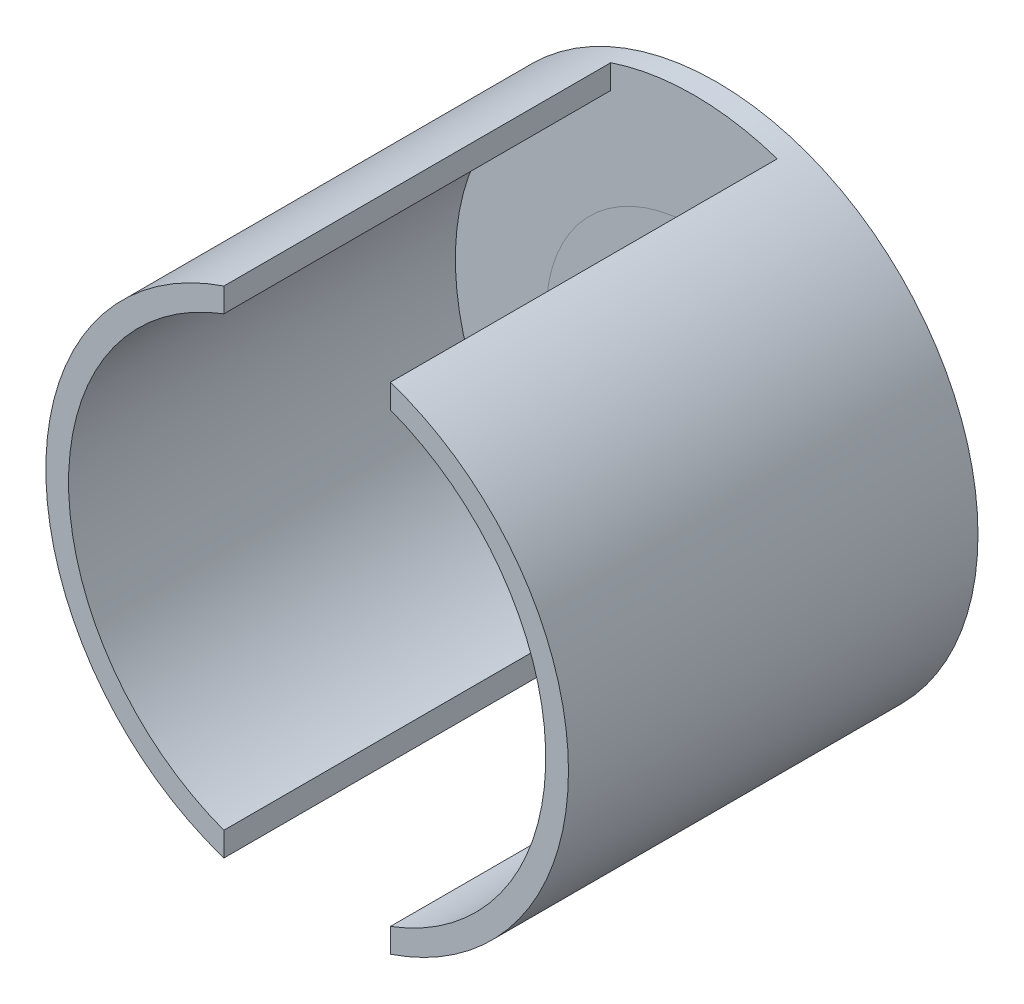
from build123d import *

# Parameters (mm, degrees)
SCHIZZO1_R                    = 19.5
SCHIZZO1_R_2                  = 1.75
ESTRUSIONE_ESTRUSIONE1_DEPTH  = 3
TAGLIO_ESTRUSIONE1_DEPTH      = 1
SCHIZZO5_R                    = 34.52
SCHIZZO5_R_2                  = 19.5
ESTRUSIONE_ESTRUSIONE4_DEPTH  = 3
SCHIZZO6_R                    = 34.52
SCHIZZO6_R_2                  = 31.52
ESTRUSIONE_ESTRUSIONE5_DEPTH  = 51.1
TAGLIO_ESTRUSIONE2_DEPTH      = 73.870232606
TAGLIO_ESTRUSIONE2_DEPTH_BACK = 73.870232606
SCHIZZO7_W                    = 22
SCHIZZO7_H                    = 51.1


with BuildPart() as part:
    # Schizzo1 → Estrusione-Estrusione1 (new body)
    with BuildSketch(Plane.XY):
        Circle(SCHIZZO1_R)
        with Locations((5.5, 9)):
            Circle(SCHIZZO1_R_2, mode=Mode.SUBTRACT)
        with Locations((-5.5, 9)):
            Circle(SCHIZZO1_R_2, mode=Mode.SUBTRACT)
        with Locations((-5.5, -9)):
            Circle(SCHIZZO1_R_2, mode=Mode.SUBTRACT)
        with Locations((5.5, -9)):
            Circle(SCHIZZO1_R_2, mode=Mode.SUBTRACT)
    extrude(amount=ESTRUSIONE_ESTRUSIONE1_DEPTH)

    # Schizzo2 → Taglio-Estrusione1 (cut)
    with BuildSketch(Plane(origin=(0, 0, 0), x_dir=(-1, 0, 0), z_dir=(0, 0, -1))):
        Polygon((7.665063509, 5.25), (9.830127019, 9), (7.665063509, 12.75), (3.334936491, 12.75), (1.169872981, 9), (3.334936491, 5.25), align=None)
        Polygon((3.334936491, -12.75), (7.665063509, -12.75), (9.830127019, -9), (7.665063509, -5.25), (3.334936491, -5.25), (1.169872981, -9), align=None)
        Polygon((-7.665063509, -12.75), (-3.334936491, -12.75), (-1.169872981, -9), (-3.334936491, -5.25), (-7.665063509, -5.25), (-9.830127019, -9), align=None)
        Polygon((-3.334936491, 5.25), (-1.169872981, 9), (-3.334936491, 12.75), (-7.665063509, 12.75), (-9.830127019, 9), (-7.665063509, 5.25), align=None)
    extrude(amount=-TAGLIO_ESTRUSIONE1_DEPTH, mode=Mode.SUBTRACT)


with BuildPart() as body_2:
    # Schizzo5 → Estrusione-Estrusione4 (new body)
    with BuildSketch(Plane.XY.offset(3)):
        Circle(SCHIZZO5_R)
        Circle(SCHIZZO5_R_2, mode=Mode.SUBTRACT)
    extrude(amount=-ESTRUSIONE_ESTRUSIONE4_DEPTH)

    # Schizzo6 → Estrusione-Estrusione5 (add)
    with BuildSketch(Plane.XY.offset(3)):
        Circle(SCHIZZO6_R)
        with Locations(Location((0, 0, 0), (0, 0, 90))):
            Circle(SCHIZZO6_R_2, mode=Mode.SUBTRACT)
    extrude(amount=ESTRUSIONE_ESTRUSIONE5_DEPTH)

    # Schizzo7 → Taglio-Estrusione2 (cut, two sides: drawn at the far end of the back side and taken through both)
    with BuildSketch(Plane(origin=(0, 0, 0), x_dir=(1, 0, 0), z_dir=(0, 1, 0)).offset(-TAGLIO_ESTRUSIONE2_DEPTH_BACK)):
        with Locations((0, -28.55)):
            Rectangle(SCHIZZO7_W, SCHIZZO7_H)
    extrude(amount=TAGLIO_ESTRUSIONE2_DEPTH + TAGLIO_ESTRUSIONE2_DEPTH_BACK, mode=Mode.SUBTRACT)


solid = Compound([part.part, body_2.part])
